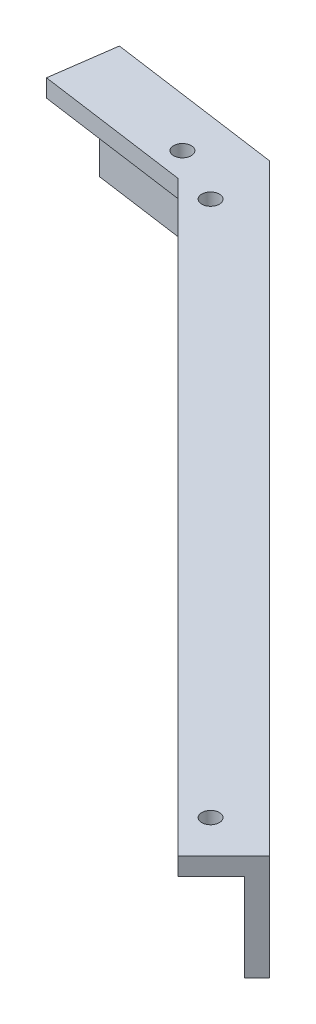
from build123d import *

# Parameters (mm, degrees)
CROQUIS1_R                = 1.5
SALIENTE_EXTRUIR2_DEPTH   = 3
SALIENTE_EXTRUIR2_2_DEPTH = 3
SALIENTE_EXTRUIR3_DEPTH   = 3
CROQUIS4_R                = 1.5
CORTAR_EXTRUIR2_DEPTH     = 3
SALIENTE_EXTRUIR4_START   = -3
CROQUIS5_R                = 1.5
SALIENTE_EXTRUIR4_DEPTH   = 3
SALIENTE_EXTRUIR5_DEPTH   = 15
CROQUIS7_R                = 1.5
CORTAR_EXTRUIR3_DEPTH     = 15
CROQUIS8_R                = 1.5
CORTAR_EXTRUIR4_DEPTH     = 15
CROQUIS9_R                = 1.5
CORTAR_EXTRUIR5_DEPTH     = 15
CROQUIS10_W               = 207.078994109
CROQUIS10_H               = 142.865408101
CORTAR_EXTRUIR6_DEPTH     = 20
SALIENTE_EXTRUIR6_DEPTH   = 3
CORTAR_EXTRUIR9_DEPTH     = 6
SALIENTE_EXTRUIR8_DEPTH   = 6
CROQUIS14_W               = 35.322230026
CROQUIS14_H               = 29.345994137
CORTAR_EXTRUIR10_DEPTH    = 3
CROQUIS15_W               = 36.043333432
CROQUIS15_H               = 18.319096506
CORTAR_EXTRUIR12_DEPTH    = 10
SALIENTE_EXTRUIR9_DEPTH   = 15
CROQUIS17_R               = 1.5
CORTAR_EXTRUIR14_DEPTH    = 30
CROQUIS18_R               = 1.5
CORTAR_EXTRUIR15_DEPTH    = 30


with BuildPart() as part:
    # Croquis1 → Saliente-Extruir2 (new body)
    with BuildSketch(Plane(origin=(0, 0, 0), x_dir=(1, 0, 0), z_dir=(0, 1, 0))):
        Polygon((35, 0), (65, 0), (167.530483272, -102.530483272), (161.873629023, -108.187337522), (61.686291501, -8), (35, -8), align=None)
        with Locations(Location((50, -4, 0), (0, 0, 270))):
            Circle(CROQUIS1_R, mode=Mode.SUBTRACT)
        with Locations(Location((159.045201898, -99.702056147, 0), (0, 0, 270))):
            Circle(CROQUIS1_R, mode=Mode.SUBTRACT)
        with Locations(Location((67.828427125, -8.485281374, 0), (0, 0, 270))):
            Circle(CROQUIS1_R, mode=Mode.SUBTRACT)
    extrude(amount=SALIENTE_EXTRUIR2_DEPTH)



with BuildPart() as body_2:
    # Croquis1 → Saliente-Extruir2 2 (new body)
    with BuildSketch(Plane(origin=(0, 0, 0), x_dir=(1, 0, 0), z_dir=(0, 1, 0))):
        Polygon((-35, 0), (-65, 0), (-167.530483272, -102.530483272), (-161.873629023, -108.187337522), (-61.686291501, -8), (-35, -8), align=None)
        with Locations(Location((-50, -4, 0), (0, 0, 270))):
            Circle(CROQUIS1_R, mode=Mode.SUBTRACT)
        with Locations(Location((-67.828427125, -8.485281374, 0), (0, 0, 270))):
            Circle(CROQUIS1_R, mode=Mode.SUBTRACT)
        with Locations(Location((-159.045201898, -99.702056147, 0), (0, 0, 270))):
            Circle(CROQUIS1_R, mode=Mode.SUBTRACT)
    extrude(amount=SALIENTE_EXTRUIR2_2_DEPTH)


with BuildPart() as part_1:
    add(part.part)

    add(body_2.part)  # Saliente-Extruir3 merges body 2
    # Croquis3 → Saliente-Extruir3 (add)
    with BuildSketch(Plane(origin=(0, 3, 0), x_dir=(1, 0, 0), z_dir=(0, 1, 0))):
        Polygon((-161.873629023, -108.187337522), (-159.752308679, -110.308657865), (-60.443650814, -11), (-35, -11), (-35, -8), (-61.686291501, -8), align=None)
        Polygon((35, -8), (61.686291501, -8), (161.873629023, -108.187337522), (159.752308679, -110.308657865), (60.443650814, -11), (35, -11), align=None)
    extrude(amount=-SALIENTE_EXTRUIR3_DEPTH)

    # Croquis4 → Cortar-Extruir2 (cut)
    with BuildSketch(Plane(origin=(0, 3, 0), x_dir=(1, 0, 0), z_dir=(0, 1, 0))):
        with Locations(Location((-50, -7.1, 0), (0, 0, 270))):
            Circle(CROQUIS4_R)
        with Locations(Location((-65.636396103, -10.677312396, 0), (0, 0, 270))):
            Circle(CROQUIS4_R)
        with Locations(Location((-156.853170876, -101.894087169, 0), (0, 0, 270))):
            Circle(CROQUIS4_R)
        with Locations(Location((50, -7.1, 0), (0, 0, 270))):
            Circle(CROQUIS4_R)
        with Locations(Location((65.636396103, -10.677312396, 0), (0, 0, 270))):
            Circle(CROQUIS4_R)
        with Locations(Location((156.853170876, -101.894087169, 0), (0, 0, 270))):
            Circle(CROQUIS4_R)
    extrude(amount=-CORTAR_EXTRUIR2_DEPTH, mode=Mode.SUBTRACT)

    # Croquis5 → Saliente-Extruir4 (add)
    with BuildSketch(Plane(origin=(0, 3, 0), x_dir=(1, 0, 0), z_dir=(0, 1, 0)).offset(SALIENTE_EXTRUIR4_START)):
        with Locations((-159.045201898, -99.702056147)):
            Circle(CROQUIS5_R)
        with Locations((-67.828427125, -8.485281374)):
            Circle(CROQUIS5_R)
        with Locations((-50, -4)):
            Circle(CROQUIS5_R)
        with Locations((50, -4)):
            Circle(CROQUIS5_R)
        with Locations((67.828427125, -8.485281374)):
            Circle(CROQUIS5_R)
        with Locations((159.045201898, -99.702056147)):
            Circle(CROQUIS5_R)
    extrude(amount=SALIENTE_EXTRUIR4_DEPTH)

    # Croquis6 → Saliente-Extruir5 (add)
    with BuildSketch(Plane(origin=(0, 0, 0), x_dir=(-1, 0, 0), z_dir=(0, -1, 0))):
        Polygon((167.530483272, -102.530483272), (65, 0), (35, 0), (35, -3), (63.757359313, -3), (165.409162928, -104.651803616), align=None)
        Polygon((-35, 0), (-35, -3), (-63.757359313, -3), (-165.409162928, -104.651803616), (-167.530483272, -102.530483272), (-65, 0), align=None)
    extrude(amount=SALIENTE_EXTRUIR5_DEPTH)

    # Croquis7 → Cortar-Extruir3 (cut)
    with BuildSketch(Plane(origin=(0, 0, 0), x_dir=(-1, 0, 0), z_dir=(0, 0, -1))):
        with Locations((50, -7.5)):
            Circle(CROQUIS7_R)
        with Locations((-50, -7.5)):
            Circle(CROQUIS7_R)
    extrude(amount=-CORTAR_EXTRUIR3_DEPTH, mode=Mode.SUBTRACT)

    # Croquis8 → Cortar-Extruir4 (cut)
    with BuildSketch(Plane(origin=(-32.5, 0, -32.5), x_dir=(-0.7071067811865476, 0, 0.7071067811865476), z_dir=(-0.7071067811865476, 0, -0.7071067811865476))):
        with Locations((182.961940777, -7.5)):
            Circle(CROQUIS8_R)
        with Locations((53.961940777, -7.5)):
            Circle(CROQUIS8_R)
    extrude(amount=-CORTAR_EXTRUIR4_DEPTH, mode=Mode.SUBTRACT)

    # Croquis9 → Cortar-Extruir5 (cut)
    with BuildSketch(Plane(origin=(32.5, 0, -32.5), x_dir=(-0.7071067811865476, 0, -0.7071067811865476), z_dir=(0.7071067811865476, 0, -0.7071067811865476))):
        with Locations((-182.961940777, -7.5)):
            Circle(CROQUIS9_R)
        with Locations((-53.961940777, -7.5)):
            Circle(CROQUIS9_R)
    extrude(amount=-CORTAR_EXTRUIR5_DEPTH, mode=Mode.SUBTRACT)

    # Croquis10 → Cortar-Extruir6 (cut)
    with BuildSketch(Plane(origin=(0, 3, 0), x_dir=(1, 0, 0), z_dir=(0, 1, 0))):
        with Locations((-138.539497055, -71.432704051)):
            Rectangle(CROQUIS10_W, CROQUIS10_H)
    extrude(amount=-CORTAR_EXTRUIR6_DEPTH, mode=Mode.SUBTRACT)

    # Croquis11 → Saliente-Extruir6 (add)
    with BuildSketch(Plane(origin=(0, 3, 0), x_dir=(1, 0, 0), z_dir=(0, 1, 0))):
        Polygon((65, 0), (35.287813482, 4.145596742), (33.767761344, -6.748871648), (59.828674856, -10.385024042), (60.443650814, -11), align=None)
    extrude(amount=SALIENTE_EXTRUIR6_DEPTH)

    # Croquis12 → Cortar-Extruir9 (cut)
    with BuildSketch(Plane(origin=(0, 6, 0), x_dir=(1, 0, 0), z_dir=(0, 1, 0))):
        Polygon((35, -6.920799909), (35, -11), (60.443650814, -11), (59.828674856, -10.385024042), align=None)
    extrude(amount=-CORTAR_EXTRUIR9_DEPTH, mode=Mode.SUBTRACT)

    # Croquis13 → Saliente-Extruir8 (add)
    with BuildSketch(Plane(origin=(0, 6, 0), x_dir=(1, 0, 0), z_dir=(0, 1, 0))):
        Polygon((35.287813482, 4.145596742), (33.767761344, -6.748871648), (59.828674856, -10.385024042), (60.443650814, -11), (65, 0), align=None)
    extrude(amount=-SALIENTE_EXTRUIR8_DEPTH)

    # Croquis14 → Cortar-Extruir10 (cut)
    with BuildSketch(Plane(origin=(0, 6, 0), x_dir=(1, 0, 0), z_dir=(0, 1, 0))):
        with Locations((49.859763615, -7.874178501)):
            Rectangle(CROQUIS14_W, CROQUIS14_H)
    extrude(amount=-CORTAR_EXTRUIR10_DEPTH, mode=Mode.SUBTRACT)

    # Croquis15 → Cortar-Extruir12 (cut)
    with BuildSketch(Plane(origin=(1.241209114, 0, -8.895953705), x_dir=(-0.9904062172531622, 0, -0.1381865580520849), z_dir=(0.1381865580520849, 0, -0.9904062172531622))):
        with Locations((-46.354737405, -9.159548253)):
            Rectangle(CROQUIS15_W, CROQUIS15_H)
    extrude(amount=-CORTAR_EXTRUIR12_DEPTH, mode=Mode.SUBTRACT)

    # Croquis16 → Saliente-Extruir9 (add)
    with BuildSketch(Plane(origin=(0, 0, 0), x_dir=(-1, 0, 0), z_dir=(0, -1, 0))):
        Polygon((-35.287813482, 4.145596742), (-65, 0), (-64.480524839, -3.723165526), (-63.589638597, -2.832279284), (-34.873253808, 1.17437809), align=None)
        Polygon((-66.286556106, -3.282217184), (-65, 0), (-64.480524839, -3.723165526), align=None)
    extrude(amount=SALIENTE_EXTRUIR9_DEPTH)

    # Croquis17 → Cortar-Extruir14 (cut)
    with BuildSketch(Plane(origin=(0, -15, 0), x_dir=(-1, 0, 0), z_dir=(0, -1, 0))):
        with Locations(Location((-56.0956257, -5.926391678, 0), (0, 0, 90))):
            Circle(CROQUIS17_R)
    extrude(amount=-CORTAR_EXTRUIR14_DEPTH, mode=Mode.SUBTRACT)

    # Croquis18 → Cortar-Extruir15 (cut)
    with BuildSketch(Plane(origin=(1.241209114, 0, -8.895953705), x_dir=(-0.9904062172531622, 0, -0.1381865580520849), z_dir=(0.1381865580520849, 0, -0.9904062172531622))):
        with Locations((-56.376404121, -4.1)):
            Circle(CROQUIS18_R)
    extrude(amount=-CORTAR_EXTRUIR15_DEPTH, mode=Mode.SUBTRACT)


solid = part_1.part
